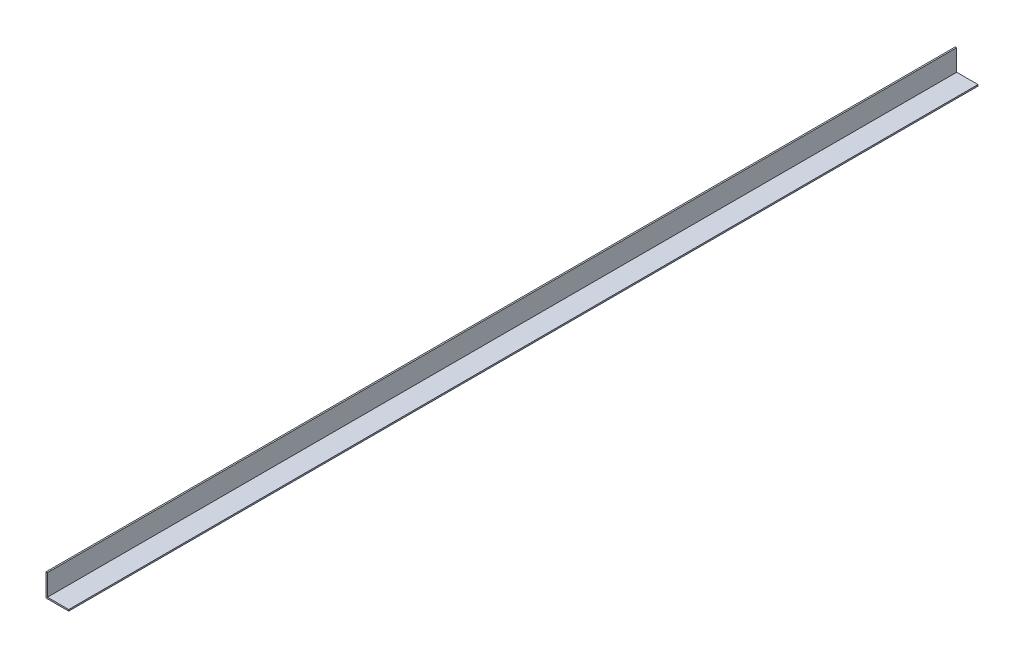
from build123d import *

# Parameters (mm, degrees)
SALIENTE_EXTRUIR1_DEPTH = 6100


with BuildPart() as part:
    # Croquis1 → Saliente-Extruir1 (new body)
    with BuildSketch(Plane.XY):
        Polygon((0, 152.4), (0, 0), (152.4, 0), (152.4, 9.53), (9.53, 9.53), (9.53, 152.4), align=None)
    extrude(amount=-SALIENTE_EXTRUIR1_DEPTH)


solid = part.part
